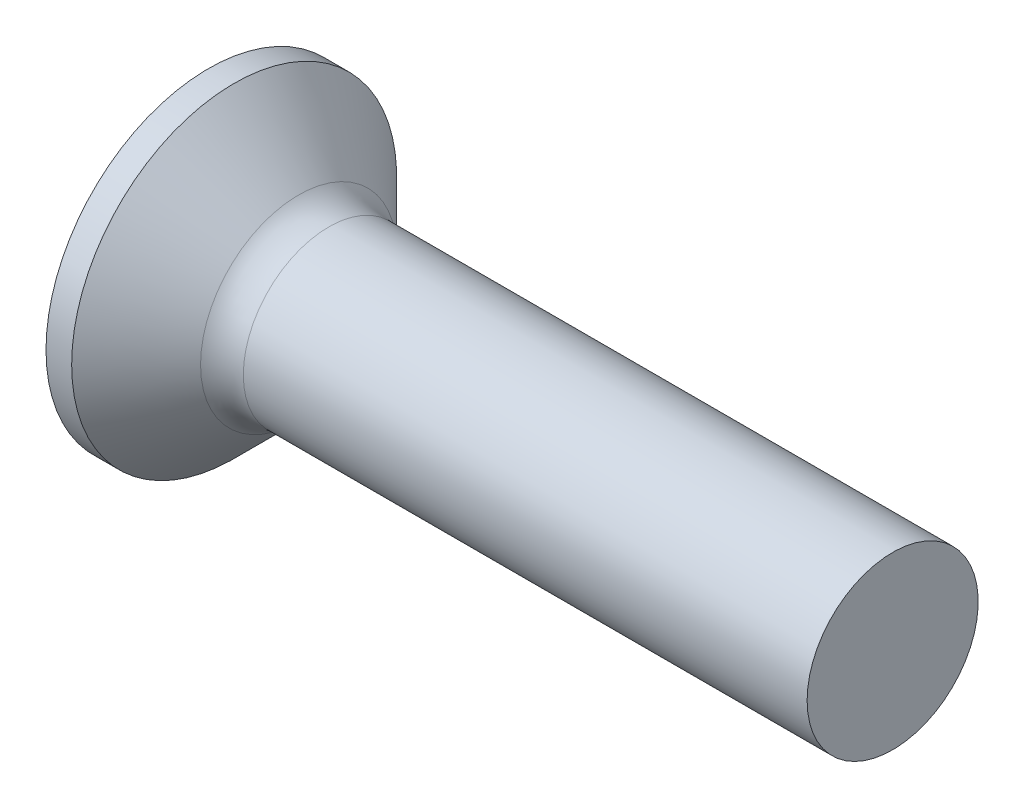
from build123d import *

# Parameters (mm, degrees)
FILLET1_R    = 0.5
RECPAT_COUNT = 2
RECPAT_ANGLE = 90


with BuildPart() as part:
    # BodySke → Base-Revolve (revolve)
    with BuildSketch(Plane.XY, mode=Mode.PRIVATE) as base_revolve_sk:
        Polygon((0, 0), (0, 1.9), (0.3, 1.9), (1.2, 1), (8, 1), (8, 0), align=None)
    revolve(base_revolve_sk.sketch.rotate(Axis((-6.35, 0, 0), (1, 0, 0)), 90), axis=Axis((-6.35, 0, 0), (1, 0, 0)))

    # Fillet1
    fillet1_edges = [part.edges().sort_by_distance(p)[0] for p in [
        (1.2, 0, -1),
    ]]
    fillet(fillet1_edges, radius=FILLET1_R)

    # Sketch3 → Recess section 0
    with BuildSketch(Plane.ZY):
        with BuildLine():
            Line((-0.24, 0.95), (0.24, 0.95))
            Line((0.24, 0.95), (0.24, -0.95))
            Line((0.24, -0.95), (-0.24, -0.95))
            Line((-0.24, -0.95), (-0.24, 0.95))
        make_face()
    # Sketch4 → Recess section 1
    with BuildSketch(Plane.ZY.offset(-1.2)):
        with BuildLine():
            Line((-0.24, 0.351702091), (0.24, 0.351702091))
            Line((0.24, 0.351702091), (0.24, -0.351702091))
            Line((0.24, -0.351702091), (-0.24, -0.351702091))
            Line((-0.24, -0.351702091), (-0.24, 0.351702091))
        make_face()
    recess = loft(mode=Mode.SUBTRACT)

    # RecPat: Recess ×2 about axis
    recpat_axis = Axis((0, 0, 0), (1, 0, 0))
    for i in range(1, RECPAT_COUNT):
        add(recess.rotate(recpat_axis, i * RECPAT_ANGLE / (RECPAT_COUNT - 1)), mode=Mode.SUBTRACT)

    # RecCorSke → RecessCore (revolve, cut)
    with BuildSketch(Plane.XY, mode=Mode.PRIVATE) as recesscore_sk:
        Polygon((0, 0), (0, 0.439412174), (1.2, 0.3555), (1.315508952, 0), align=None)
    revolve(recesscore_sk.sketch.rotate(Axis((-3.175, 0, 0), (1, 0, 0)), 90), axis=Axis((-3.175, 0, 0), (1, 0, 0)), mode=Mode.SUBTRACT)


solid = part.part
